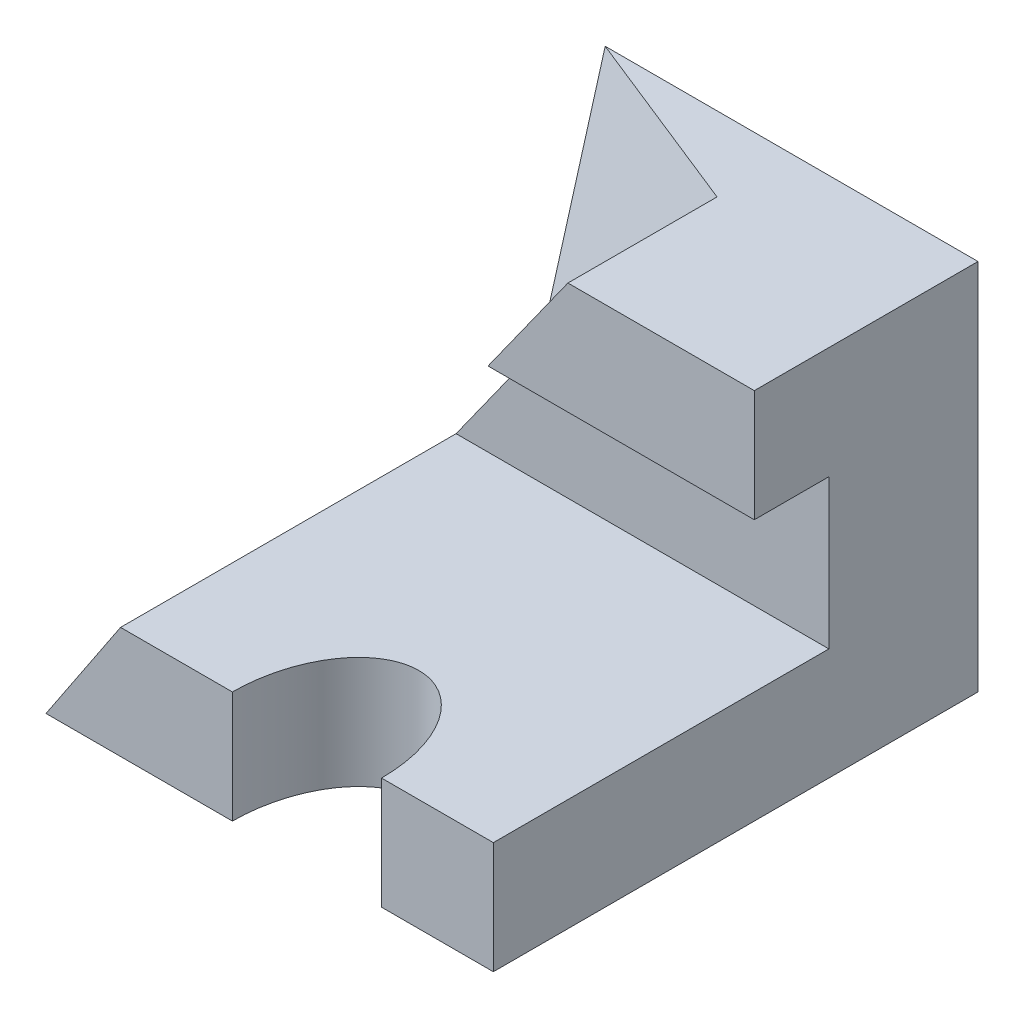
from build123d import *

# Parameters (mm, degrees)
BOSS_EXTRUDE1_DEPTH = 65
BOSS_EXTRUDE2_DEPTH = 30
BOSS_EXTRUDE3_DEPTH = 20
BOSS_EXTRUDE4_DEPTH = 10
CUT_EXTRUDE1_DEPTH  = 10
CUT_EXTRUDE3_DEPTH  = 90.162772501


with BuildPart() as part:
    # Sketch1 → Boss-Extrude1 (new body)
    with BuildSketch(Plane.XY):
        Polygon((50, 0), (0, 0), (-10, -15), (50, -15), align=None)
    extrude(amount=BOSS_EXTRUDE1_DEPTH)



with BuildPart() as body_2:
    # Sketch1<3> → Boss-Extrude2 (new body)
    with BuildSketch(Plane.XY):
        Polygon((25, 35), (14.285714286, 20), (50, 20), (50, 35), align=None)
    extrude(amount=BOSS_EXTRUDE2_DEPTH)


with BuildPart() as part_1:
    add(part.part)

    add(body_2.part)  # Boss-Extrude3 merges body 2
    # Sketch1<4> → Boss-Extrude3 (add)
    with BuildSketch(Plane.XY):
        Polygon((14.285714286, 20), (0, 0), (50, 0), (50, 20), align=None)
    extrude(amount=BOSS_EXTRUDE3_DEPTH)

    # Sketch1<5> → Boss-Extrude4 (add)
    with BuildSketch(Plane.XY):
        Polygon((0, 35), (0, 0), (14.285714286, 20), (25, 35), align=None)
    extrude(amount=BOSS_EXTRUDE4_DEPTH)

    # Sketch2 → Cut-Extrude1 (cut, along a direction that is not the sketch's normal)
    with BuildSketch(Plane(origin=(-3.22156476, 2.301117686, 8.0539119), x_dir=(0.9333474217026252, 0.09861784078368246, 0.34516244274287194), z_dir=(-0.3589743589743731, 0.2564102564102665, 0.8974358974358889))):
        Polygon((30.236934397, 30.906126888), (3.451624427, 33.653338167), (3.451624427, -2.747211279), align=None)
    extrude(amount=CUT_EXTRUDE1_DEPTH, dir=(0, 0, 1), mode=Mode.SUBTRACT)

    # Sketch4 → Cut-Extrude3 (cut, through all)
    with BuildSketch(Plane(origin=(0, 0, 0), x_dir=(1, 0, 0), z_dir=(0, 1, 0))):
        with BuildLine():
            Line((15, -65), (35, -65))
            add(Edge.make_bspline(
                [(35, -65), (35, -50), (25, -50), (15, -50), (15, -65)],
                knots=[1.570796327, 1.570796327, 1.570796327, 3.141592654, 3.141592654, 4.71238898, 4.71238898, 4.71238898], degree=2, weights=[1, 0.707106781, 1, 0.707106781, 1]))
        make_face()
    extrude(amount=-CUT_EXTRUDE3_DEPTH, mode=Mode.SUBTRACT)


solid = part_1.part
